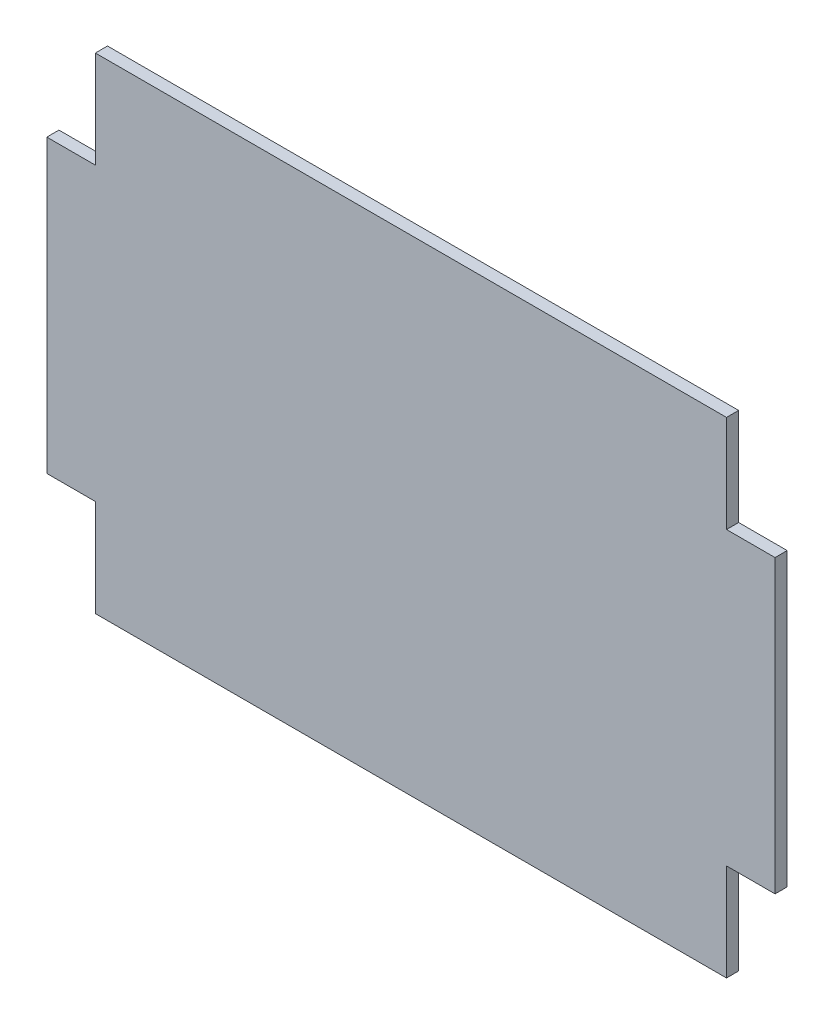
from build123d import *

# Parameters (mm, degrees)
SKETCH1_W           = 300
SKETCH1_H           = 200
BOSS_EXTRUDE1_DEPTH = 5
SKETCH3_W           = 20
SKETCH3_H           = 20
SKETCH3_H_2         = 40
CUT_EXTRUDE1_DEPTH  = 5
SKETCH4_W           = 20
SKETCH4_H           = 40
CUT_EXTRUDE2_DEPTH  = 10


with BuildPart() as part:
    # Sketch1 → Boss-Extrude1 (new body)
    with BuildSketch(Plane.XY):
        Rectangle(SKETCH1_W, SKETCH1_H)
    extrude(amount=BOSS_EXTRUDE1_DEPTH)

    # Sketch3 → Cut-Extrude1 (cut)
    with BuildSketch(Plane.XY.offset(5)):
        with Locations((-140, -90)):
            Rectangle(SKETCH3_W, SKETCH3_H)
        with Locations((-140, 80)):
            Rectangle(SKETCH3_W, SKETCH3_H_2)
        with Locations((140, 80)):
            Rectangle(SKETCH3_W, SKETCH3_H_2)
        with Locations((140, -90)):
            Rectangle(SKETCH3_W, SKETCH3_H)
    extrude(amount=-CUT_EXTRUDE1_DEPTH, mode=Mode.SUBTRACT)

    # Sketch4 → Cut-Extrude2 (cut)
    with BuildSketch(Plane(origin=(0, 0, 0), x_dir=(-1, 0, 0), z_dir=(0, 0, -1))):
        with Locations((-140, -80)):
            Rectangle(SKETCH4_W, SKETCH4_H)
        with Locations((140, -80)):
            Rectangle(SKETCH4_W, SKETCH4_H)
    extrude(amount=-CUT_EXTRUDE2_DEPTH, mode=Mode.SUBTRACT)


solid = part.part
